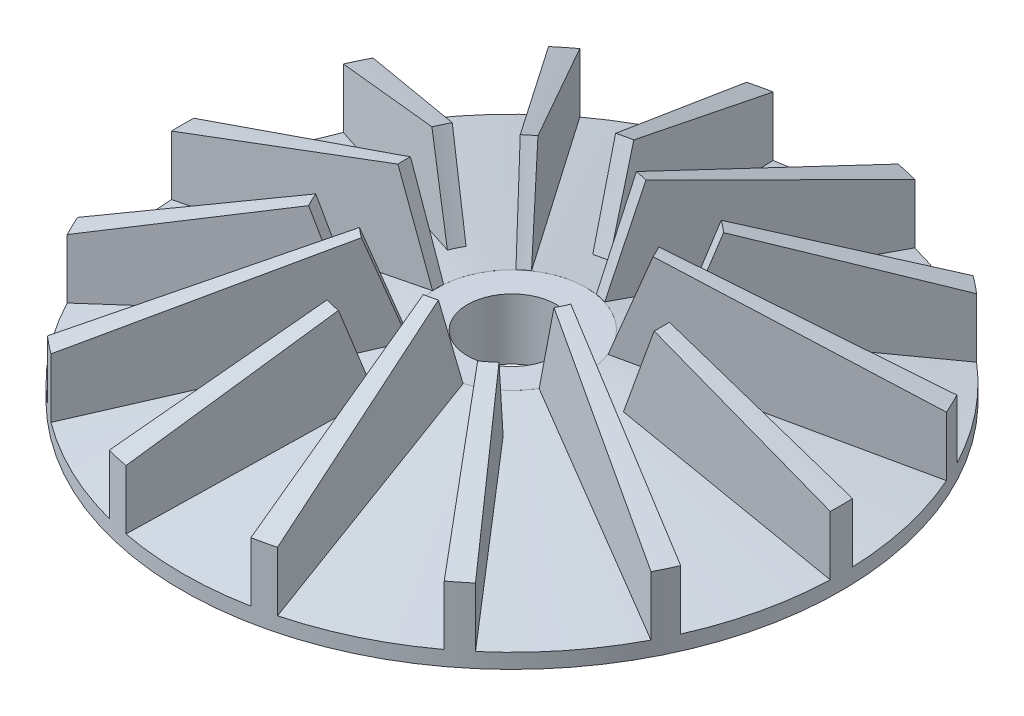
from build123d import *

# Parameters (mm, degrees)
SECONDARY_START              = -13
SECONDARY_VANES_DEPTH        = 13
SECONDARY_VANE_PATTERM_COUNT = 7
PRIMARY_START                = 13
PRIMARY_VANE_EXTRUDE_DEPTH   = 13
PRIMARY_VANE_PATTERN_COUNT   = 7


with BuildPart() as part:
    # Sketch2 → base (revolve)
    with BuildSketch(Plane.XY, mode=Mode.PRIVATE) as base_sk:
        Polygon((3, 0), (22.225, 0), (22.225, 1), (3, 4.460067492), align=None)
    revolve(base_sk.sketch.rotate(Axis((0, 0, 0), (0, 1, 0)), 90), axis=Axis((0, 0, 0), (0, 1, 0)))

    # Sketch3 → secondary vanes (add)
    with BuildSketch(Plane.XZ.offset(SECONDARY_START)):
        with BuildLine():
            Line((7.986056917, -0.472117489), (22.212341727, -0.75))
            ThreePointArc((22.212341727, -0.75), (22.225, 0), (22.212341727, 0.75))
            Line((22.212341727, 0.75), (7.986056917, 0.472117489))
            ThreePointArc((7.986056917, 0.472117489), (8, 0), (7.986056917, -0.472117489))
        make_face()
    secondary_vanes = extrude(amount=SECONDARY_VANES_DEPTH)

    # secondary vane patterm: secondary vanes ×7 about axis
    secondary_vane_patterm_axis = Axis((0, 0, 0), (0, 1, 0))
    for i in range(1, SECONDARY_VANE_PATTERM_COUNT):
        add(secondary_vanes.rotate(secondary_vane_patterm_axis, i * 360 / SECONDARY_VANE_PATTERM_COUNT))

    # Sketch6 → secondary angle trim (revolve, cut)
    with BuildSketch(Plane.XY):
        Polygon((8, 3.560179978), (11.435813505, 13), (3, 13), (3, 4.460067492), align=None)
    revolve(axis=Axis((0, 0, 0), (0, 1, 0)), mode=Mode.SUBTRACT)

    # Sketch10 → primary vane extrude (add)
    with BuildSketch(Plane(origin=(0, 0, 0), x_dir=(1, 0, 0), z_dir=(0, 1, 0)).offset(PRIMARY_START)):
        with BuildLine():
            Line((4.654766424, -1.825691524), (20.337998107, -8.961944991))
            ThreePointArc((20.337998107, -8.961944991), (20.024033089, -9.643066102), (19.687265148, -10.313205903))
            Line((19.687265148, -10.313205903), (4.329582506, -2.500942887))
            ThreePointArc((4.329582506, -2.500942887), (4.50484434, -2.169418696), (4.654766424, -1.825691524))
        make_face()
    primary_vane_extrude = extrude(amount=-PRIMARY_VANE_EXTRUDE_DEPTH)

    # primary vane pattern: primary vane extrude ×7 about axis
    primary_vane_pattern_axis = Axis((0, 0, 0), (0, 1, 0))
    for i in range(1, PRIMARY_VANE_PATTERN_COUNT):
        add(primary_vane_extrude.rotate(primary_vane_pattern_axis, i * 360 / PRIMARY_VANE_PATTERN_COUNT))

    # Sketch11 → primary angle trim (revolve, cut)
    with BuildSketch(Plane(origin=(0, 0, 0), x_dir=(0.9009688679024188, 0, 0.43388373911755895), z_dir=(-0.43388373911755895, 0, 0.9009688679024188)), mode=Mode.PRIVATE) as primary_angle_trim_sk:
        Polygon((5, 4.100112486), (3, 4.460067492), (3, 18), (3, 19.59164627), (10.638457181, 19.59164627), align=None)
    revolve(primary_angle_trim_sk.sketch.rotate(Axis((0, 0, 0), (0, 1, 0)), 115.714285714), axis=Axis((0, 0, 0), (0, 1, 0)), mode=Mode.SUBTRACT)

    # Sketch12 → Cut-Revolve5 (revolve, cut)
    with BuildSketch(Plane.XY, mode=Mode.PRIVATE) as cut_revolve5_sk:
        Polygon((22.225, 5), (22.225, 13), (7.582654653, 17.407849679), (6.464025405, 10.673241699), align=None)
    revolve(cut_revolve5_sk.sketch.rotate(Axis((0, 0, 0), (0, 1, 0)), 90), axis=Axis((0, 0, 0), (0, 1, 0)), mode=Mode.SUBTRACT)

    # Sketch14 → Cut-Revolve6 (revolve, cut)
    with BuildSketch(Plane(origin=(0, 0, 0), x_dir=(0.9009688679024188, 0, 0.43388373911755895), z_dir=(-0.43388373911755895, 0, 0.9009688679024188)), mode=Mode.PRIVATE) as cut_revolve6_sk:
        Polygon((4.9859375, 4.100112486), (0, 4.100112486), (0, 18), align=None)
    revolve(cut_revolve6_sk.sketch.rotate(Axis((0, 4.100112486, 0), (0, 1, 0)), 107.155334111), axis=Axis((0, 4.100112486, 0), (0, 1, 0)), mode=Mode.SUBTRACT)


solid = part.part
